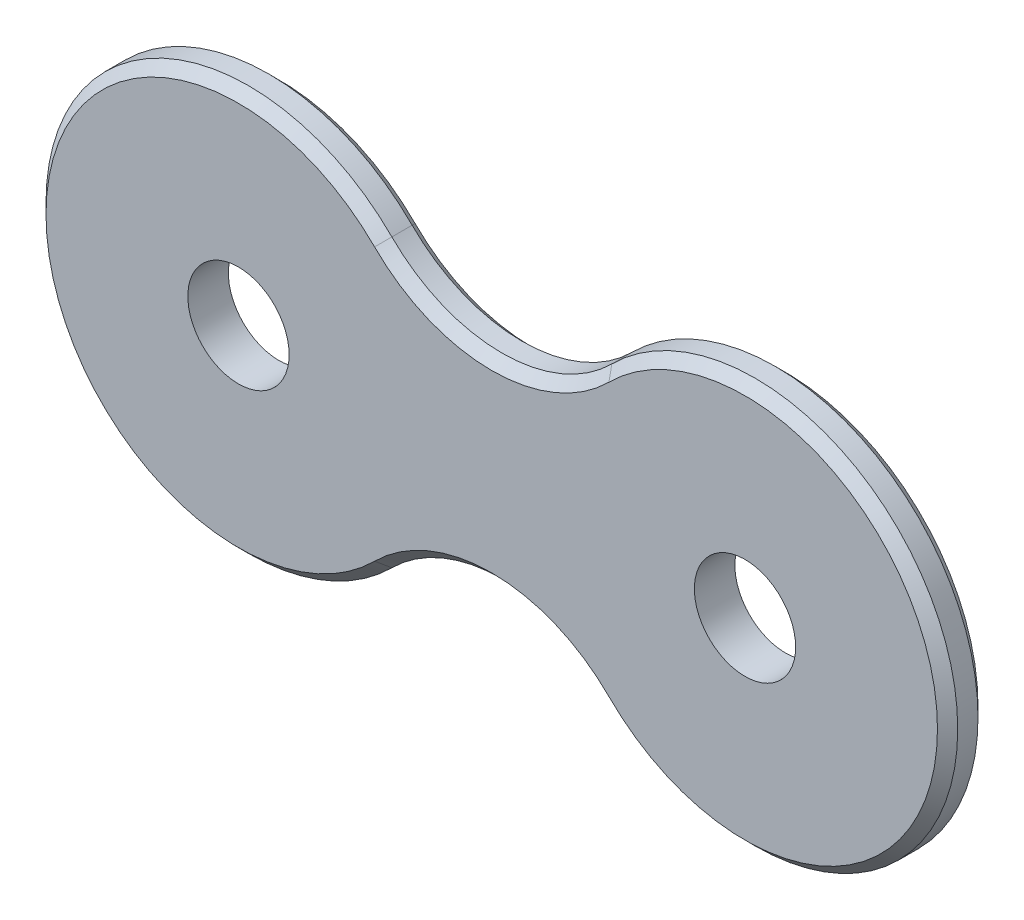
from build123d import *

# Parameters (mm, degrees)
SKETCH1_R           = 2.5
BOSS_EXTRUDE1_DEPTH = 2
CHAMFER1_SIZE       = 0.5


with BuildPart() as part:
    # Sketch1 → Boss-Extrude1 (new body)
    with BuildSketch(Plane.XY):
        with BuildLine():
            ThreePointArc((17.928932188, -7.071067812), (35, 0), (17.928932188, 7.071067812))
            ThreePointArc((17.928932188, 7.071067812), (12.5, 4.82233047), (7.071067812, 7.071067812))
            ThreePointArc((7.071067812, 7.071067812), (-10, 0), (7.071067812, -7.071067812))
            ThreePointArc((7.071067812, -7.071067812), (12.5, -4.82233047), (17.928932188, -7.071067812))
        make_face()
        with Locations((25, 0)):
            Circle(SKETCH1_R, mode=Mode.SUBTRACT)
        Circle(SKETCH1_R, mode=Mode.SUBTRACT)
    extrude(amount=BOSS_EXTRUDE1_DEPTH)

    # Chamfer1
    chamfer1_edges = [part.edges().sort_by_distance(p)[0] for p in [
        (12.5, -4.82233047, 2),
        (-10, 0, 2),
        (12.5, 4.82233047, 2),
        (-10, 0, 0),
        (12.5, -4.82233047, 0),
        (35, 0, 0),
        (12.5, 4.82233047, 0),
        (35, 0, 2),
    ]]
    chamfer(chamfer1_edges, length=CHAMFER1_SIZE)


solid = part.part
